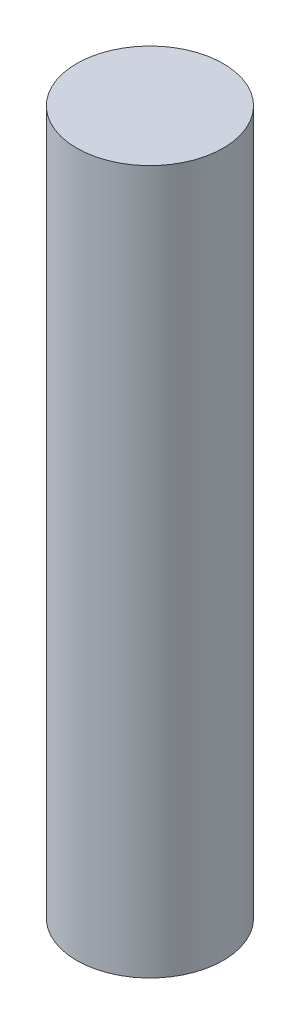
from build123d import *

# Parameters (mm, degrees)
SKETCH1_R           = 7.5
BOSS_EXTRUDE1_DEPTH = 72


with BuildPart() as part:
    # Sketch1 → Boss-Extrude1 (new body)
    with BuildSketch(Plane(origin=(0, 0, 0), x_dir=(1, 0, 0), z_dir=(0, 1, 0))):
        with Locations(Location((0, 0, 0), (0, 0, 270))):
            Circle(SKETCH1_R)
    extrude(amount=BOSS_EXTRUDE1_DEPTH)


solid = part.part
